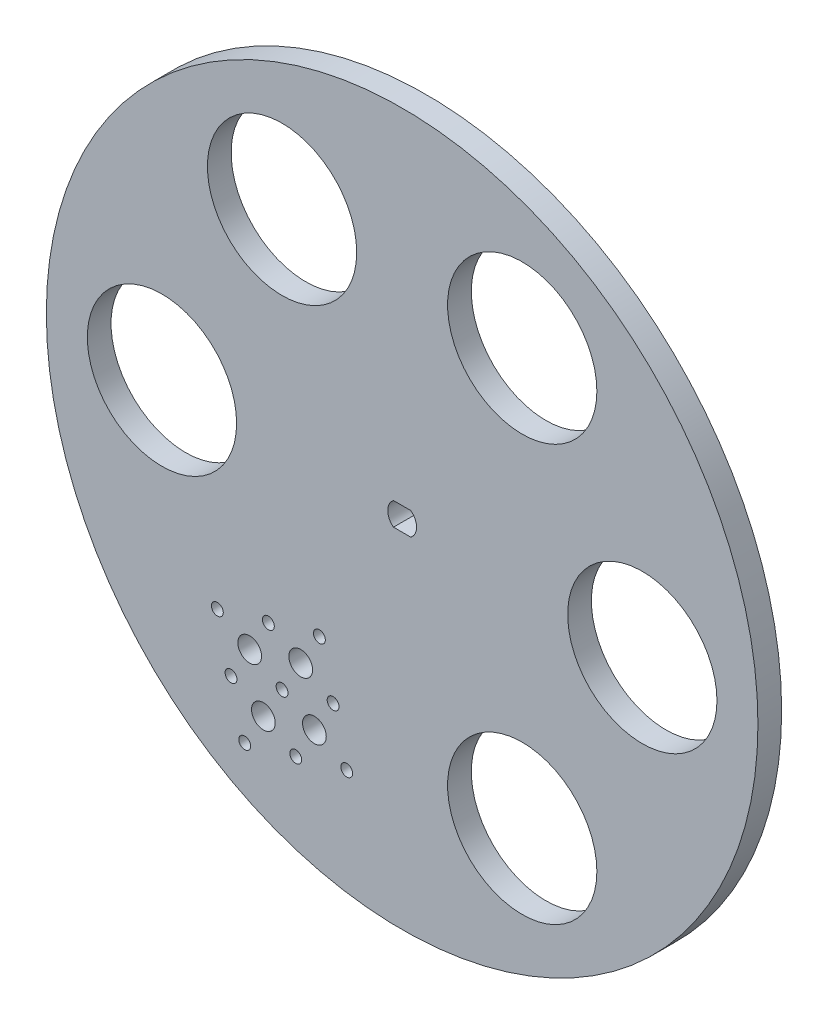
from build123d import *

# Parameters (mm, degrees)
SKETCH_1_R          = 60
EXTRUDE_1_DEPTH     = 4
SKETCH_2_R          = 12.5875
SKETCH_2_R_2        = 1
SKETCH_2_R_3        = 2
CUT_EXTRUDE_2_DEPTH = 4
EXTRUDE_START       = -2.85
SKETCH_2_4_R        = 4.5
EXTRUDE_2_DEPTH     = 2.85


with BuildPart() as part:
    # 草圖1 → 填料-伸長1 (new body)
    with BuildSketch(Plane.XY):
        Circle(SKETCH_1_R)
    extrude(amount=EXTRUDE_1_DEPTH)

    # 草圖2 → 除料-伸長2 (cut)
    with BuildSketch(Plane.XY):
        with BuildLine():
            ThreePointArc((-1.46, 1.942498391), (-2.43, 0), (-1.46, -1.942498391))
            Line((-1.46, -1.942498391), (1.46, -1.942498391))
            ThreePointArc((1.46, -1.942498391), (2.43, 0), (1.46, 1.942498391))
            Line((1.46, 1.942498391), (-1.46, 1.942498391))
        make_face()
        with Locations((-40.5, 0)):
            Circle(SKETCH_2_R)
        with Locations((-20.25, 35.074028853)):
            Circle(SKETCH_2_R)
        with Locations((20.25, 35.074028853)):
            Circle(SKETCH_2_R)
        with Locations((40.5, 0)):
            Circle(SKETCH_2_R)
        with Locations((20.25, -35.074028853)):
            Circle(SKETCH_2_R)
        with Locations((-20.25, -35.074028853)):
            Circle(SKETCH_2_R_2)
        with Locations((-17.1, -29.618068809)):
            Circle(SKETCH_2_R_3)
        with Locations((-22.555960044, -26.468068809)):
            Circle(SKETCH_2_R_2)
        with Locations((-11.644039956, -32.768068809)):
            Circle(SKETCH_2_R_2)
        with Locations((-17.944039956, -43.679988897)):
            Circle(SKETCH_2_R_2)
        with Locations((-28.855960044, -37.379988897)):
            Circle(SKETCH_2_R_2)
        with Locations((-14.794039956, -38.224028853)):
            Circle(SKETCH_2_R_3)
        with Locations((-25.705960044, -31.924028853)):
            Circle(SKETCH_2_R_3)
        with Locations((-23.4, -40.529988897)):
            Circle(SKETCH_2_R_3)
        with Locations((-31.161920088, -28.774028853)):
            Circle(SKETCH_2_R_2)
        with Locations((-13.95, -24.162108766)):
            Circle(SKETCH_2_R_2)
        with Locations((-9.338079912, -41.374028853)):
            Circle(SKETCH_2_R_2)
        with Locations((-26.55, -45.985948941)):
            Circle(SKETCH_2_R_2)
    extrude(amount=CUT_EXTRUDE_2_DEPTH, mode=Mode.SUBTRACT)

    # 草圖2<4> → 填料-伸長2 (add)
    with BuildSketch(Plane.XY.offset(EXTRUDE_START)):
        Circle(SKETCH_2_4_R)
        with BuildLine():
            ThreePointArc((1.46, -1.942498391), (2.43, 0), (1.46, 1.942498391))
            Line((1.46, 1.942498391), (-1.46, 1.942498391))
            ThreePointArc((-1.46, 1.942498391), (-2.43, 0), (-1.46, -1.942498391))
            Line((-1.46, -1.942498391), (1.46, -1.942498391))
        make_face(mode=Mode.SUBTRACT)
    extrude(amount=EXTRUDE_2_DEPTH)


solid = part.part
